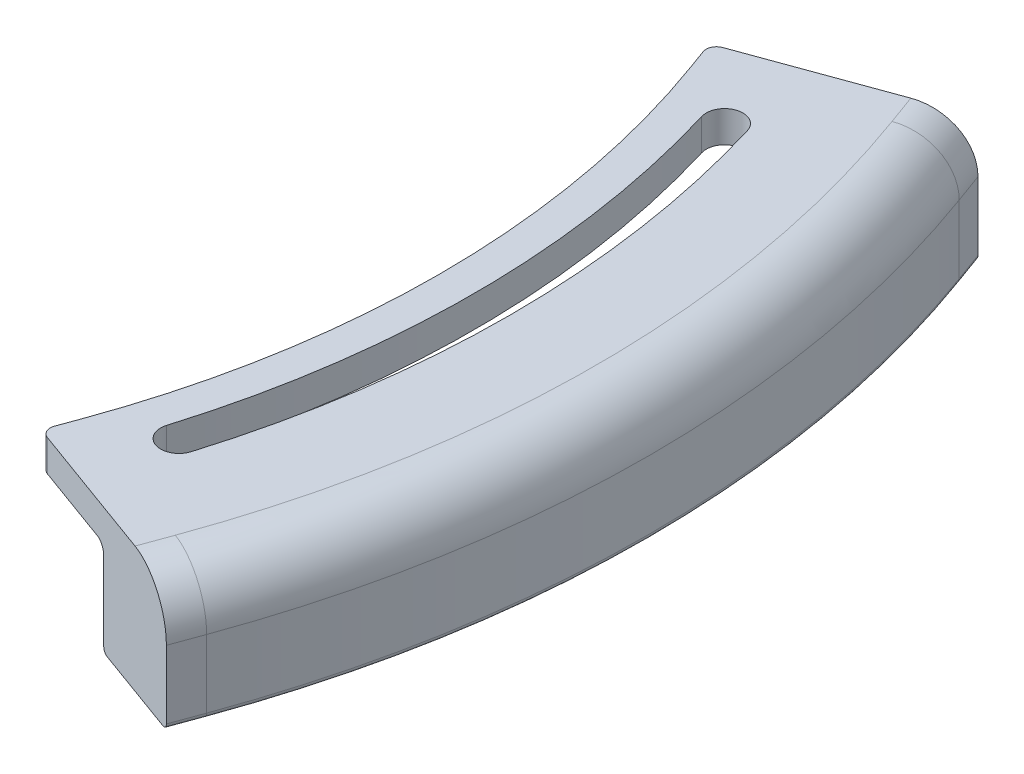
from build123d import *

# Parameters (mm, degrees)
REVOLVE_1_ANGLE     = 40
CUT_EXTRUDE_1_DEPTH = 10
FILLET_1_R          = 5
FILLET_3_R          = 1
FILLET_4_R          = 1
EXTRUDE_1_DEPTH     = 3
EXTRUDE_2_DEPTH     = 3
FILLET_6_R          = 0.5
FILLET_7_R          = 1


with BuildPart() as part:
    # 草图2 → 旋转1 (revolve, symmetric)
    with BuildSketch(Plane.XY) as revolve_1_sk:
        with BuildLine():
            Line((95, 4), (95, -5))
            Line((95, -5), (96.5, -5))
            Line((96.5, -5), (96.5, -2))
            Line((96.5, -2), (97.763932023, -2))
            ThreePointArc((97.763932023, -2), (100, -1), (102.236067977, -2))
            Line((102.236067977, -2), (103.5, -2))
            Line((103.5, -2), (103.5, -5))
            Line((103.5, -5), (105, -5))
            Line((105, -5), (105, 7))
            Line((105, 7), (85, 7))
            Line((85, 7), (85, 4))
            Line((85, 4), (95, 4))
        make_face()
    revolve(axis=Axis((0, 24.366902053, 0), (0, -1, 0)), revolution_arc=REVOLVE_1_ANGLE / 2)
    revolve(revolve_1_sk.sketch, axis=Axis((0, 24.366902053, 0), (0, 1, 0)), revolution_arc=REVOLVE_1_ANGLE / 2)

    # 草图3 → 切除-拉伸1 (cut)
    with BuildSketch(Plane(origin=(0, 7, 0), x_dir=(1, 0, 0), z_dir=(0, 1, 0))):
        with BuildLine():
            ThreePointArc((87.826997293, -26.542061834), (91.75, 1.18e-07), (87.826997225, 26.542062061))
            ThreePointArc((87.826997225, 26.542062061), (85.645571172, 27.710984674), (84.476648452, 25.529558679))
            ThreePointArc((84.476648452, 25.529558679), (88.25, 3.69e-07), (84.476648665, -25.529557973))
            ThreePointArc((84.476648665, -25.529557973), (85.645570933, -27.710984602), (87.826997293, -26.542061834))
        make_face()
    extrude(amount=-CUT_EXTRUDE_1_DEPTH, mode=Mode.SUBTRACT)

    # 圆角1
    fillet_1_edges = [part.edges().sort_by_distance(p)[0] for p in [
        (105, 7, 0),
    ]]
    fillet(fillet_1_edges, radius=FILLET_1_R)

    # 圆角3
    fillet_3_edges = [part.edges().sort_by_distance(p)[0] for p in [
        (95, 4, 0),
    ]]
    fillet(fillet_3_edges, radius=FILLET_3_R)

    # 圆角4
    fillet_4_edges = [part.edges().sort_by_distance(p)[0] for p in [
        (103.5, -2, 0),
        (96.5, -2, 0),
    ]]
    fillet(fillet_4_edges, radius=FILLET_4_R)

    # 草图5 → 凸台-拉伸1 (add)
    with BuildSketch(Plane(origin=(0, 0, 0), x_dir=(0.9396926207859081, 0, 0.34202014332566955), z_dir=(-0.34202014332566955, 0, 0.9396926207859082))):
        with BuildLine():
            Line((96.5, -5), (103.5, -5))
            Line((103.5, -5), (103.5, -3))
            ThreePointArc((103.5, -3), (103.207106781, -2.292893219), (102.5, -2))
            Line((102.5, -2), (102.236067977, -2))
            ThreePointArc((102.236067977, -2), (100, -1), (97.763932023, -2))
            Line((97.763932023, -2), (97.5, -2))
            ThreePointArc((97.5, -2), (96.792893219, -2.292893219), (96.5, -3))
            Line((96.5, -3), (96.5, -5))
        make_face()
        with BuildLine():
            Line((103.5, -5), (105, -5))
            Line((105, -5), (105, 2))
            ThreePointArc((105, 2), (103.535533906, 5.535533906), (100, 7))
            Line((100, 7), (85, 7))
            Line((85, 7), (85, 4))
            Line((85, 4), (94, 4))
            ThreePointArc((94, 4), (94.707106781, 3.707106781), (95, 3))
            Line((95, 3), (95, -5))
            Line((95, -5), (96.5, -5))
            Line((96.5, -5), (96.5, -3))
            ThreePointArc((96.5, -3), (96.792893219, -2.292893219), (97.5, -2))
            Line((97.5, -2), (97.763932023, -2))
            ThreePointArc((97.763932023, -2), (100, -1), (102.236067977, -2))
            Line((102.236067977, -2), (102.5, -2))
            ThreePointArc((102.5, -2), (103.207106781, -2.292893219), (103.5, -3))
            Line((103.5, -3), (103.5, -5))
        make_face()
    extrude(amount=EXTRUDE_1_DEPTH)

    # 草图6 → 凸台-拉伸2 (add)
    with BuildSketch(Plane(origin=(0, 0, 0), x_dir=(-0.9396926207859082, 0, 0.34202014332566943), z_dir=(-0.34202014332566943, 0, -0.9396926207859082))):
        with BuildLine():
            Line((-103.5, -5), (-96.5, -5))
            Line((-96.5, -5), (-96.5, -3))
            ThreePointArc((-96.5, -3), (-96.792893219, -2.292893219), (-97.5, -2))
            Line((-97.5, -2), (-97.763932023, -2))
            ThreePointArc((-97.763932023, -2), (-100, -1), (-102.236067977, -2))
            Line((-102.236067977, -2), (-102.5, -2))
            ThreePointArc((-102.5, -2), (-103.207106781, -2.292893219), (-103.5, -3))
            Line((-103.5, -3), (-103.5, -5))
        make_face()
        with BuildLine():
            Line((-85, 4), (-85, 7))
            Line((-85, 7), (-100, 7))
            ThreePointArc((-100, 7), (-103.535533906, 5.535533906), (-105, 2))
            Line((-105, 2), (-105, -5))
            Line((-105, -5), (-103.5, -5))
            Line((-103.5, -5), (-103.5, -3))
            ThreePointArc((-103.5, -3), (-103.207106781, -2.292893219), (-102.5, -2))
            Line((-102.5, -2), (-102.236067977, -2))
            ThreePointArc((-102.236067977, -2), (-100, -1), (-97.763932023, -2))
            Line((-97.763932023, -2), (-97.5, -2))
            ThreePointArc((-97.5, -2), (-96.792893219, -2.292893219), (-96.5, -3))
            Line((-96.5, -3), (-96.5, -5))
            Line((-96.5, -5), (-95, -5))
            Line((-95, -5), (-95, 3))
            ThreePointArc((-95, 3), (-94.707106781, 3.707106781), (-94, 4))
            Line((-94, 4), (-85, 4))
        make_face()
    extrude(amount=EXTRUDE_2_DEPTH)

    # 圆角6
    fillet_6_edges = [part.edges().sort_by_distance(p)[0] for p in [
        (88.75776876, -5, 33.901452547),
        (98.154694968, -5, 37.32165398),
        (98.154694968, -5, -37.32165398),
        (88.75776876, -5, -33.901452547),
        (105, -5, 0),
        (103.5, -5, 0),
        (96.5, -5, 0),
        (95, -5, 0),
    ]]
    fillet(fillet_6_edges, radius=FILLET_6_R)

    # 圆角7
    fillet_7_edges = [part.edges().sort_by_distance(p)[0] for p in [
        (79.360842552, 4, 30.481251114),
        (78.847812337, 5.5, 31.890790045),
        (79.360842552, 4, -30.481251114),
        (78.847812337, 5.5, -31.890790045),
        (85, 4, 0),
    ]]
    fillet(fillet_7_edges, radius=FILLET_7_R)


solid = part.part
